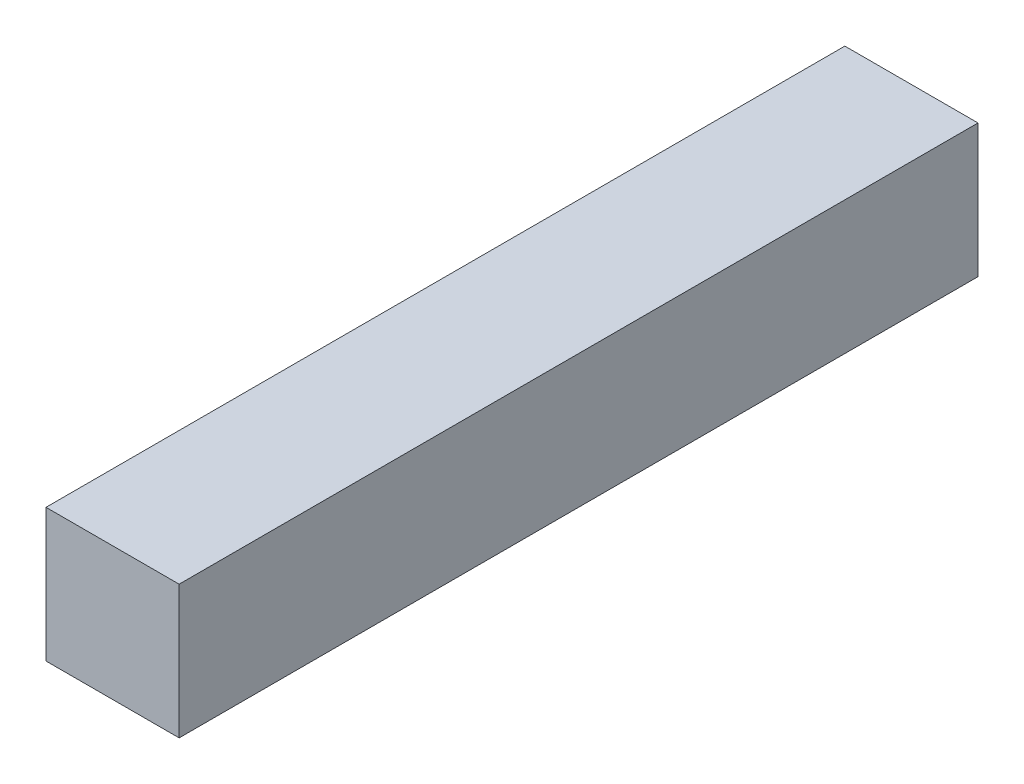
from build123d import *

# Parameters (mm, degrees)
SKETCH1_W           = 3
SKETCH1_H           = 3
BOSS_EXTRUDE1_DEPTH = 18


with BuildPart() as part:
    # Sketch1 → Boss-Extrude1 (new body)
    with BuildSketch(Plane.XY):
        Rectangle(SKETCH1_W, SKETCH1_H)
    extrude(amount=BOSS_EXTRUDE1_DEPTH)


solid = part.part
